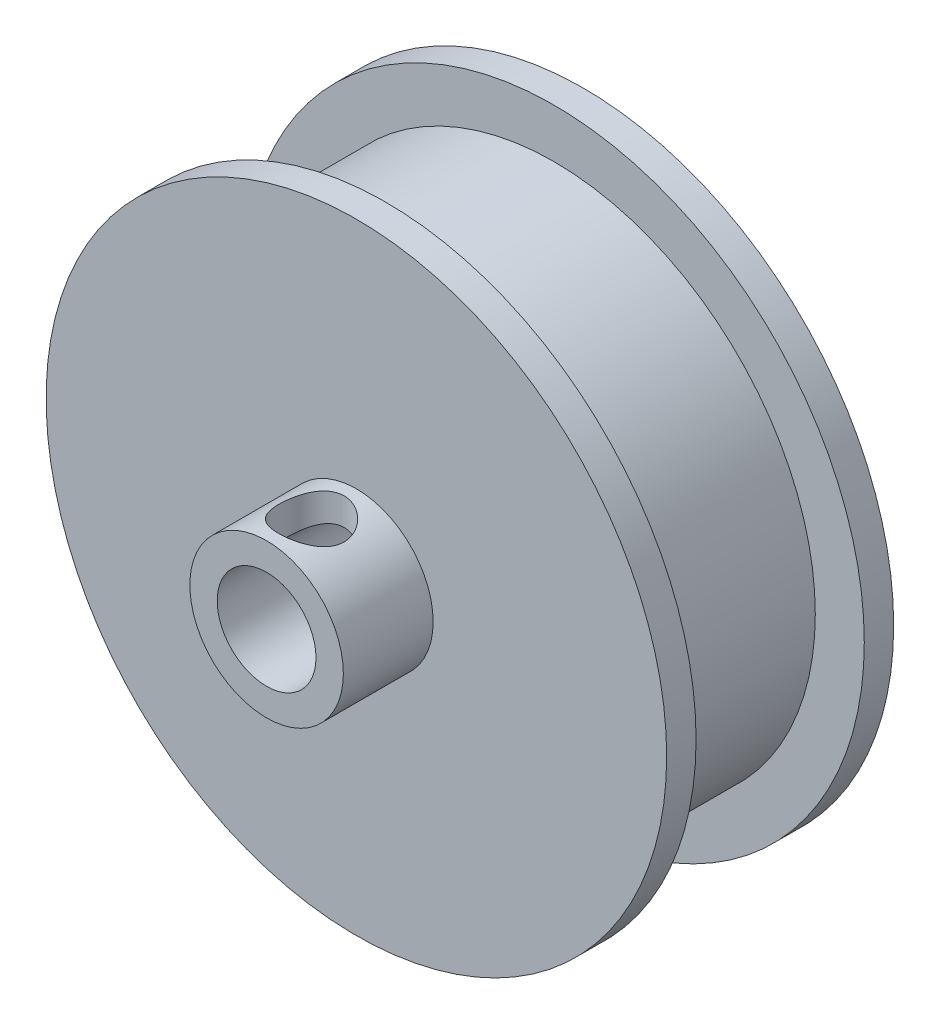
from build123d import *

# Parameters (mm, degrees)
ESQUISSE1_R             = 19
ESQUISSE1_R_2           = 3.025
BOSS_EXTRU_1_DEPTH      = 6.95
ESQUISSE2_R             = 50
ESQUISSE2_R_2           = 16
ENL_V_MAT_EXTRU_1_DEPTH = 5.15
ESQUISSE4_R             = 4.7
ESQUISSE4_R_2           = 3.025
BOSS_EXTRU_2_DEPTH      = 5.5
ESQUISSE5_R             = 2
ENL_V_MAT_EXTRU_3_DEPTH = 30.614227999


with BuildPart() as part:
    # Esquisse1 → Boss.-Extru.1 (new, symmetric)
    with BuildSketch(Plane.XY):
        Circle(ESQUISSE1_R)
        Circle(ESQUISSE1_R_2, mode=Mode.SUBTRACT)
    extrude(amount=BOSS_EXTRU_1_DEPTH, both=True)

    # Esquisse2 → Enlèv. mat.-Extru.1 (cut, symmetric)
    with BuildSketch(Plane.XY):
        Circle(ESQUISSE2_R)
        Circle(ESQUISSE2_R_2, mode=Mode.SUBTRACT)
    extrude(amount=ENL_V_MAT_EXTRU_1_DEPTH, both=True, mode=Mode.SUBTRACT)

    # Esquisse4 → Boss.-Extru.2 (add)
    with BuildSketch(Plane.XY.offset(6.95)):
        Circle(ESQUISSE4_R)
        Circle(ESQUISSE4_R_2, mode=Mode.SUBTRACT)
    extrude(amount=BOSS_EXTRU_2_DEPTH)

    # Esquisse5 → Enlèv. mat.-Extru.3 (cut, through all)
    with BuildSketch(Plane(origin=(0, 0, 0), x_dir=(1, 0, 0), z_dir=(0, 1, 0))):
        with Locations(Location((0, -9.7, 0), (0, 0, 90))):
            Circle(ESQUISSE5_R)
    extrude(amount=ENL_V_MAT_EXTRU_3_DEPTH, mode=Mode.SUBTRACT)


solid = part.part
